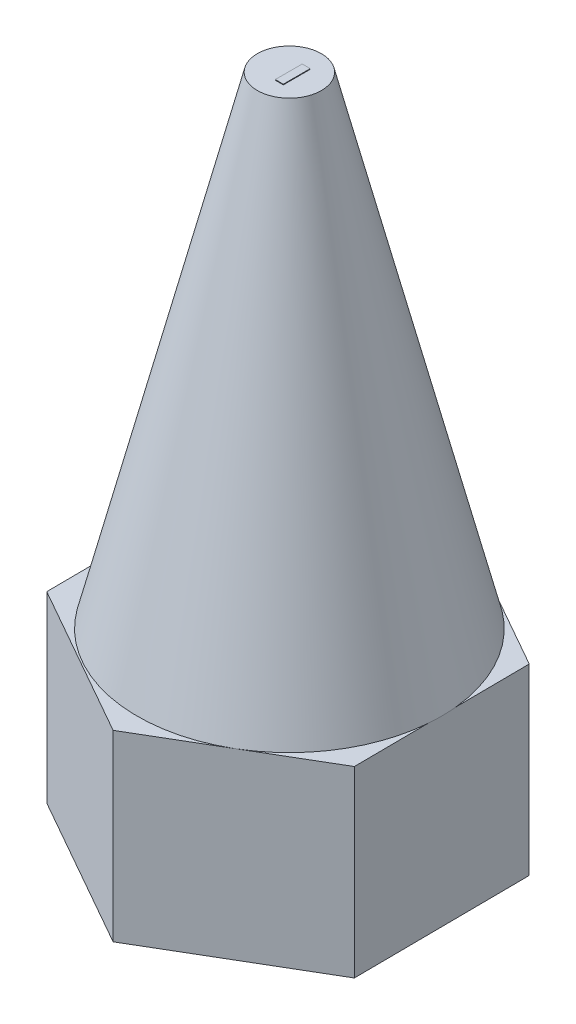
from build123d import *

# Parameters (mm, degrees)
SALIENTE_EXTRUIR1_DEPTH = 15
CROQUIS7_W              = 14.43375673
CROQUIS7_H              = 12.305430405
CORTAR_EXTRUIR1_DEPTH   = 73.231152958
CROQUIS8_R              = 1.5
CORTAR_EXTRUIR2_DEPTH   = 1
CROQUIS10_W             = 0.658671327
CROQUIS10_H             = 2.205507173
SALIENTE_EXTRUIR2_DEPTH = 0.05


with BuildPart() as part:
    # Croquis1 → Saliente-Extruir1 (new body)
    with BuildSketch(Plane(origin=(0, 0, 0), x_dir=(1, 0, 0), z_dir=(0, 1, 0))):
        Polygon((12.555498777, -7.119886502), (12.443751971, 7.313437647), (-0.111746806, 14.433324149), (-12.555498777, 7.119886502), (-12.443751971, -7.313437647), (0.111746806, -14.433324149), align=None)
    extrude(amount=SALIENTE_EXTRUIR1_DEPTH)

    # Croquis6 → Revolución3 (revolve)
    with BuildSketch(Plane.XY, mode=Mode.PRIVATE) as revoluci_n3_sk:
        Polygon((0.111746806, 15), (0.111746806, 65), (12.555498777, 15), align=None)
    revolve(revoluci_n3_sk.sketch.rotate(Axis((0.111746806, 15, 0), (0, 1, 0)), 90), axis=Axis((0.111746806, 15, 0), (0, 1, 0)))

    # Croquis7 → Cortar-Extruir1 (cut, through all)
    with BuildSketch(Plane(origin=(-6.333622792, 0, -10.776605325), x_dir=(-0.8621284260151223, 0, 0.5066898233206265), z_dir=(-0.5066898233206265, 0, -0.8621284260151223))):
        with Locations((0, 60.624376817)):
            Rectangle(CROQUIS7_W, CROQUIS7_H)
    extrude(amount=-CORTAR_EXTRUIR1_DEPTH, mode=Mode.SUBTRACT)

    # Croquis8 → Cortar-Extruir2 (cut)
    with BuildSketch(Plane(origin=(0, 0, 0), x_dir=(-1, 0, 0), z_dir=(0, -1, 0))):
        with Locations(Location((0, 0, 0), (0, 0, 90))):
            Circle(CROQUIS8_R)
    extrude(amount=-CORTAR_EXTRUIR2_DEPTH, mode=Mode.SUBTRACT)

    # Croquis10 → Saliente-Extruir2 (add)
    with BuildSketch(Plane(origin=(0, 54.471661615, 0), x_dir=(1, 0, 0), z_dir=(0, 1, 0))):
        with Locations((0.44108247, -0.051671434)):
            Rectangle(CROQUIS10_W, CROQUIS10_H)
    extrude(amount=SALIENTE_EXTRUIR2_DEPTH)


solid = part.part
